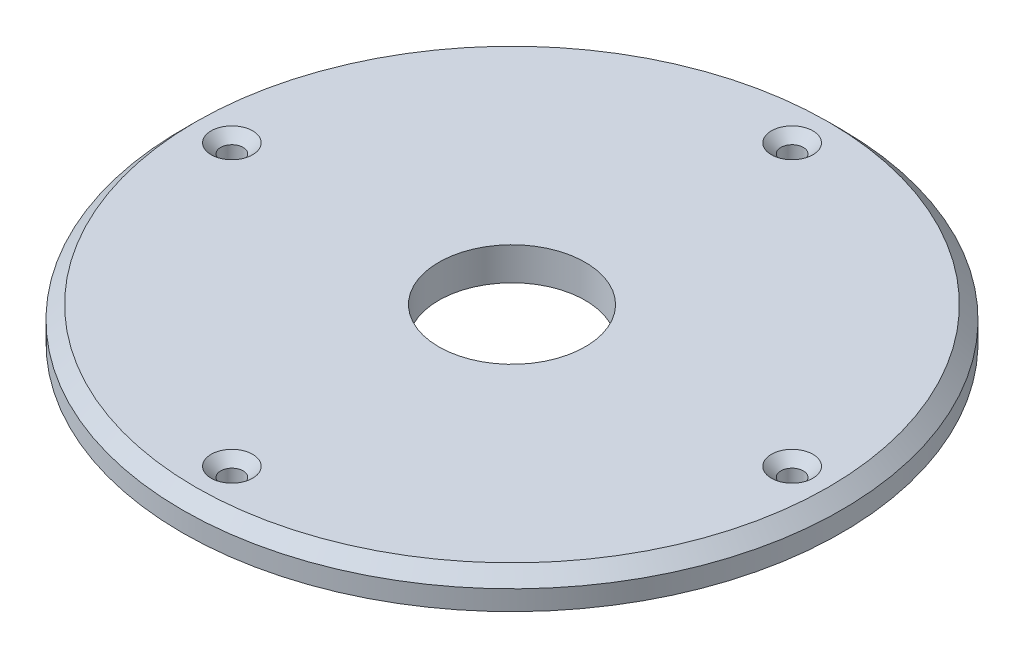
from build123d import *

# Parameters (mm, degrees)
SKETCH1_R                                       = 50
SKETCH1_R_2                                     = 11.1125
BOSS_EXTRUDE1_DEPTH                             = 5
CSK_FOR_M3_FLAT_HEAD_MACHINE_SCREW1_D           = 3.4
CSK_FOR_M3_FLAT_HEAD_MACHINE_SCREW1_CSINK_D     = 6.3
CSK_FOR_M3_FLAT_HEAD_MACHINE_SCREW1_CSINK_ANGLE = 90
CIRPATTERN1_COUNT                               = 4
CHAMFER1_SIZE                                   = 2


with BuildPart() as part:
    # Sketch1 → Boss-Extrude1 (new body)
    with BuildSketch(Plane(origin=(0, 0, 0), x_dir=(1, 0, 0), z_dir=(0, 1, 0))):
        with Locations(Location((0, 0, 0), (0, 0, 270))):
            Circle(SKETCH1_R)
        with Locations(Location((0, 0, 0), (0, 0, 270))):
            Circle(SKETCH1_R_2, mode=Mode.SUBTRACT)
    extrude(amount=BOSS_EXTRUDE1_DEPTH)

    # CSK for M3 Flat Head Machine Screw1 (through all)
    with Locations(Plane(origin=(0, 5, 0), x_dir=(1, 0, 0), z_dir=(0, 1, 0))):
        with Locations((0, 42.5)):
            csk_for_m3_flat_head_machine_screw1 = CounterSinkHole(CSK_FOR_M3_FLAT_HEAD_MACHINE_SCREW1_D / 2, CSK_FOR_M3_FLAT_HEAD_MACHINE_SCREW1_CSINK_D / 2, counter_sink_angle=CSK_FOR_M3_FLAT_HEAD_MACHINE_SCREW1_CSINK_ANGLE)

    # CirPattern1: CSK for M3 Flat Head Machine Screw1 ×4 about axis
    cirpattern1_axis = Axis((0, 0, 0), (0, 1, 0))
    for i in range(1, CIRPATTERN1_COUNT):
        add(csk_for_m3_flat_head_machine_screw1.rotate(cirpattern1_axis, i * 360 / CIRPATTERN1_COUNT), mode=Mode.SUBTRACT)

    # Chamfer1
    chamfer1_edges = [part.edges().sort_by_distance(p)[0] for p in [
        (0, 5, -50),
    ]]
    chamfer(chamfer1_edges, length=CHAMFER1_SIZE)


solid = part.part
